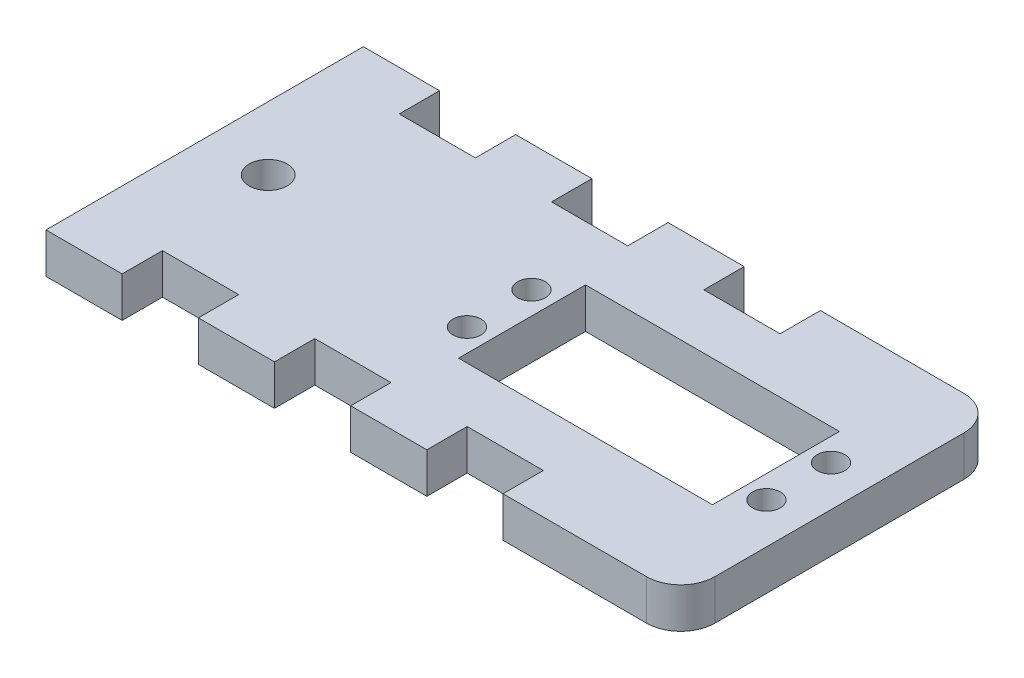
from build123d import *

# Parameters (mm, degrees)
SKETCH2_R           = 2.19
SKETCH2_R_2         = 3
SKETCH2_W           = 40
SKETCH2_H           = 20
BOSS_EXTRUDE2_DEPTH = 6.35


with BuildPart() as part:
    # Sketch2 → Boss-Extrude2 (new body)
    with BuildSketch(Plane(origin=(0, 0, 0), x_dir=(1, 0, 0), z_dir=(0, 1, 0))):
        with BuildLine():
            Line((-70, 25), (-70, -25))
            Line((-70, -25), (-58, -25))
            Line((-58, -25), (-58, -18.65))
            Line((-58, -18.65), (-46, -18.65))
            Line((-46, -18.65), (-46, -25))
            Line((-46, -25), (-34, -25))
            Line((-34, -25), (-34, -18.65))
            Line((-34, -18.65), (-22, -18.65))
            Line((-22, -18.65), (-22, -25))
            Line((-22, -25), (-10, -25))
            Line((-10, -25), (-10, -18.65))
            Line((-10, -18.65), (2, -18.65))
            Line((2, -18.65), (2, -25))
            Line((2, -25), (24.62, -25))
            ThreePointArc((24.62, -25), (28.424234483, -23.424234483), (30, -19.62))
            Line((30, -19.62), (30, 19.62))
            ThreePointArc((30, 19.62), (28.424234483, 23.424234483), (24.62, 25))
            Line((24.62, 25), (2, 25))
            Line((2, 25), (2, 18.65))
            Line((2, 18.65), (-10, 18.65))
            Line((-10, 18.65), (-10, 25))
            Line((-10, 25), (-22, 25))
            Line((-22, 25), (-22, 18.65))
            Line((-22, 18.65), (-34, 18.65))
            Line((-34, 18.65), (-34, 25))
            Line((-34, 25), (-46, 25))
            Line((-46, 25), (-46, 18.65))
            Line((-46, 18.65), (-58, 18.65))
            Line((-58, 18.65), (-58, 25))
            Line((-58, 25), (-70, 25))
        make_face()
        with Locations(Location((23.59, 5.085, 0), (0, 0, 270))):
            Circle(SKETCH2_R, mode=Mode.SUBTRACT)
        with Locations(Location((23.59, -5.085, 0), (0, 0, 270))):
            Circle(SKETCH2_R, mode=Mode.SUBTRACT)
        with Locations(Location((-23.59, 5.085, 0), (0, 0, 270))):
            Circle(SKETCH2_R, mode=Mode.SUBTRACT)
        with Locations(Location((-23.59, -5.085, 0), (0, 0, 270))):
            Circle(SKETCH2_R, mode=Mode.SUBTRACT)
        with Locations(Location((-60, 0, 0), (0, 0, 270))):
            Circle(SKETCH2_R_2, mode=Mode.SUBTRACT)
        Rectangle(SKETCH2_W, SKETCH2_H, mode=Mode.SUBTRACT)
    extrude(amount=BOSS_EXTRUDE2_DEPTH)


solid = part.part
